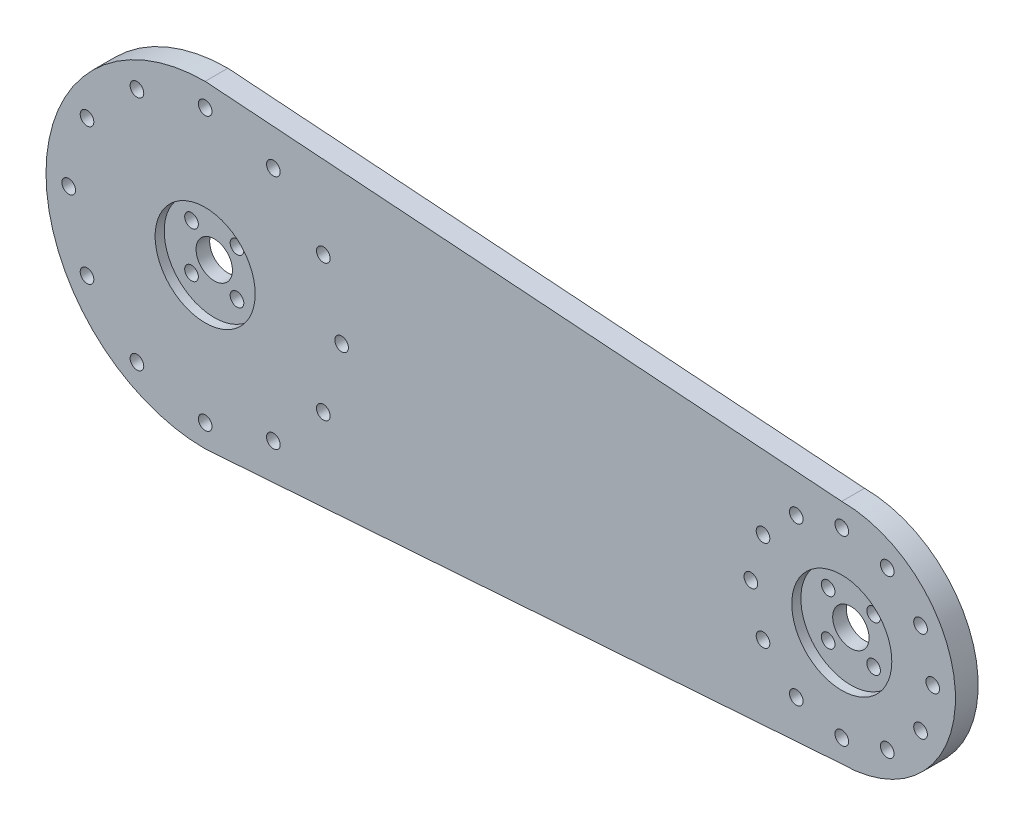
from build123d import *

# Parameters (mm, degrees)
EXTRUDE_3_DEPTH     = 5
SKETCH_4_R          = 4
SKETCH_4_R_2        = 1.5
CUT_EXTRUDE_3_DEPTH = 5
SKETCH_5_R          = 11
CUT_EXTRUDE_4_DEPTH = 2
SKETCH_6_R          = 1.5
CUT_EXTRUDE_6_DEPTH = 169.745370307


with BuildPart() as part:
    # 草图1 → 凸台-拉伸3 (new body)
    with BuildSketch(Plane.XY):
        with BuildLine():
            Line((140, 25), (0, 35))
            ThreePointArc((0, 35), (-35, 0), (0, -35))
            Line((0, -35), (140, -25))
            ThreePointArc((140, -25), (165, 0), (140, 25))
        make_face()
    extrude(amount=EXTRUDE_3_DEPTH)

    # 草图4 → 切除-拉伸3 (cut)
    with BuildSketch(Plane.XY.offset(5)):
        with Locations((140, 0)):
            Circle(SKETCH_4_R)
        Circle(SKETCH_4_R)
        with BuildLine():
            Line((-5, -3.5), (-5, -5))
            Line((-5, -5), (-3.5, -5))
            ThreePointArc((-3.5, -5), (-3.939339828, -3.939339828), (-5, -3.5))
        make_face()
        with BuildLine():
            Line((-3.5, -5), (-5, -5))
            Line((-5, -5), (-5, -3.5))
            ThreePointArc((-5, -3.5), (-6.060660172, -6.060660172), (-3.5, -5))
        make_face()
        with Locations((135, 5)):
            Circle(SKETCH_4_R_2)
        with Locations((135, -5)):
            Circle(SKETCH_4_R_2)
        with Locations((145, -5)):
            Circle(SKETCH_4_R_2)
        with Locations((145, 5)):
            Circle(SKETCH_4_R_2)
        with Locations((-5, 5)):
            Circle(SKETCH_4_R_2)
        with Locations((5, 5)):
            Circle(SKETCH_4_R_2)
        with Locations((5, -5)):
            Circle(SKETCH_4_R_2)
    extrude(amount=-CUT_EXTRUDE_3_DEPTH, mode=Mode.SUBTRACT)

    # 草图5 → 切除-拉伸4 (cut)
    with BuildSketch(Plane.XY.offset(5)):
        Circle(SKETCH_5_R)
        with Locations((140, 0)):
            Circle(SKETCH_5_R)
    extrude(amount=-CUT_EXTRUDE_4_DEPTH, mode=Mode.SUBTRACT)

    # 草图6 → 切除-拉伸6 (cut, through all)
    with BuildSketch(Plane.XY.offset(5)):
        with Locations((0, 30)):
            Circle(SKETCH_6_R)
        with Locations((15, 25.980762114)):
            Circle(SKETCH_6_R)
        with Locations((25.980762114, 15)):
            Circle(SKETCH_6_R)
        with Locations((30, 0)):
            Circle(SKETCH_6_R)
        with Locations((25.980762114, -15)):
            Circle(SKETCH_6_R)
        with Locations((15, -25.980762114)):
            Circle(SKETCH_6_R)
        with Locations((0, -30)):
            Circle(SKETCH_6_R)
        with Locations((-15, -25.980762114)):
            Circle(SKETCH_6_R)
        with Locations((-25.980762114, -15)):
            Circle(SKETCH_6_R)
        with Locations((-30, 0)):
            Circle(SKETCH_6_R)
        with Locations((-25.980762114, 15)):
            Circle(SKETCH_6_R)
        with Locations((-15, 25.980762114)):
            Circle(SKETCH_6_R)
        with Locations((140, 20)):
            Circle(SKETCH_6_R)
        with Locations((150, 17.320508076)):
            Circle(SKETCH_6_R)
        with Locations((157.320508076, 10)):
            Circle(SKETCH_6_R)
        with Locations((160, 0)):
            Circle(SKETCH_6_R)
        with Locations((157.320508076, -10)):
            Circle(SKETCH_6_R)
        with Locations((150, -17.320508076)):
            Circle(SKETCH_6_R)
        with Locations((140, -20)):
            Circle(SKETCH_6_R)
        with Locations((130, -17.320508076)):
            Circle(SKETCH_6_R)
        with Locations((122.679491924, -10)):
            Circle(SKETCH_6_R)
        with Locations((120, 0)):
            Circle(SKETCH_6_R)
        with Locations((122.679491924, 10)):
            Circle(SKETCH_6_R)
        with Locations((130, 17.320508076)):
            Circle(SKETCH_6_R)
    extrude(amount=-CUT_EXTRUDE_6_DEPTH, mode=Mode.SUBTRACT)


solid = part.part
